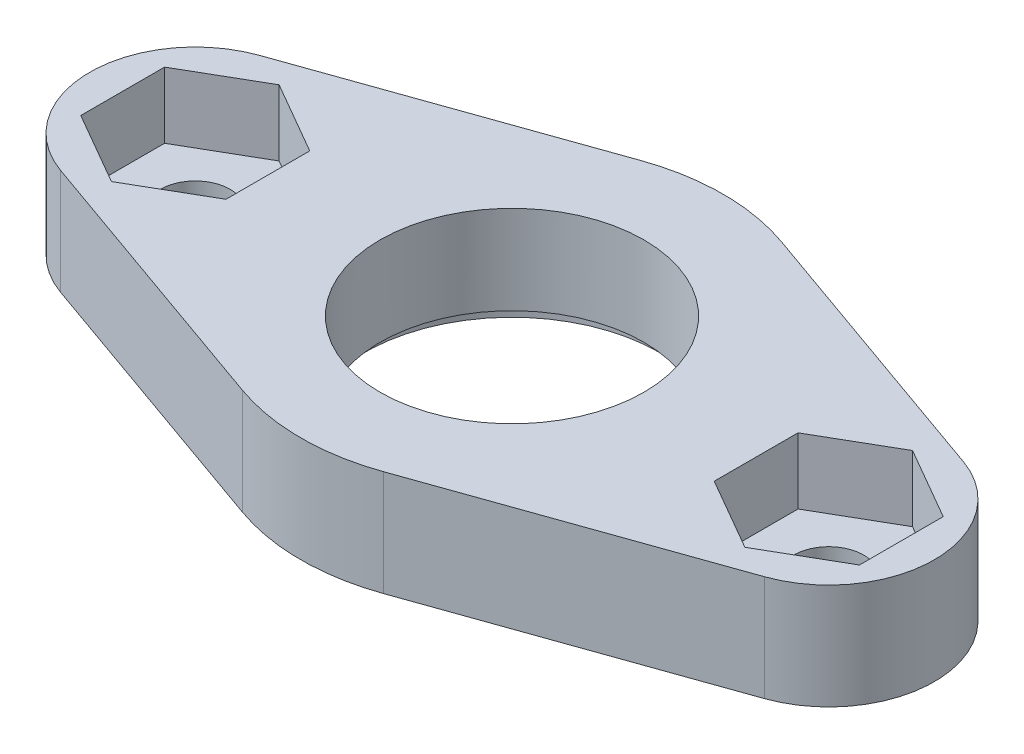
from build123d import *

# Parameters (mm, degrees)
SKETCH1_R           = 7.9375
SKETCH1_R_2         = 2.0955
WHOLE_PART_DEPTH    = 6.35
SKETCH2_R           = 8.89
BEARING_DEPTH_DEPTH = 1.016
NUT_POCKET_DEPTH    = 3.96875


with BuildPart() as part:
    # Sketch1 → whole-part (new body)
    with BuildSketch(Plane(origin=(0, 0, 0), x_dir=(1, 0, 0), z_dir=(0, 1, 0))):
        with BuildLine():
            Line((-21.166666667, 5.986837414), (-4.233333333, 11.973674828))
            ThreePointArc((-4.233333333, 11.973674828), (0, 12.7), (4.233333333, 11.973674828))
            Line((4.233333333, 11.973674828), (21.166666667, 5.986837414))
            ThreePointArc((21.166666667, 5.986837414), (25.4, 0), (21.166666667, -5.986837414))
            Line((21.166666667, -5.986837414), (4.233333333, -11.973674828))
            ThreePointArc((4.233333333, -11.973674828), (0, -12.7), (-4.233333333, -11.973674828))
            Line((-4.233333333, -11.973674828), (-21.166666667, -5.986837414))
            ThreePointArc((-21.166666667, -5.986837414), (-25.4, 0), (-21.166666667, 5.986837414))
        make_face()
        with Locations(Location((0, 0, 0), (0, 0, 270))):
            Circle(SKETCH1_R, mode=Mode.SUBTRACT)
        with Locations(Location((-19.05, 0, 0), (0, 0, 270))):
            Circle(SKETCH1_R_2, mode=Mode.SUBTRACT)
        with Locations(Location((19.05, 0, 0), (0, 0, 270))):
            Circle(SKETCH1_R_2, mode=Mode.SUBTRACT)
    extrude(amount=WHOLE_PART_DEPTH)

    # Sketch2 → bearing-depth (cut)
    with BuildSketch(Plane(origin=(0, 0, 0), x_dir=(-1, 0, 0), z_dir=(0, -1, 0))):
        with Locations(Location((0, 0, 0), (0, 0, 90))):
            Circle(SKETCH2_R)
    extrude(amount=-BEARING_DEPTH_DEPTH, mode=Mode.SUBTRACT)

    # Sketch3 → nut-pocket (cut)
    with BuildSketch(Plane(origin=(0, 6.35, 0), x_dir=(1, 0, 0), z_dir=(0, 1, 0))):
        Polygon((-23.415625, 2.520494769), (-23.415625, -2.520494769), (-19.05, -5.040989538), (-14.684375, -2.520494769), (-14.684375, 2.520494769), (-19.05, 5.040989538), align=None)
        Polygon((19.05, 5.040989538), (14.684375, 2.520494769), (14.684375, -2.520494769), (19.05, -5.040989538), (23.415625, -2.520494769), (23.415625, 2.520494769), align=None)
    extrude(amount=-NUT_POCKET_DEPTH, mode=Mode.SUBTRACT)


solid = part.part
